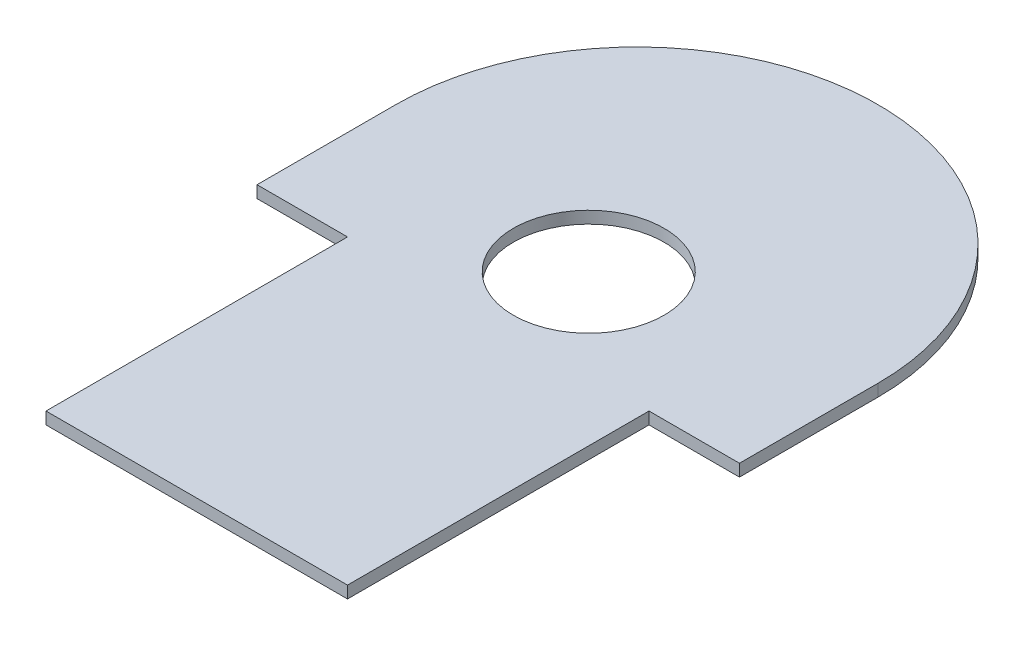
from build123d import *

# Parameters (mm, degrees)
BOSS_EXTRUDE1_DEPTH = 2
SKETCH2_R           = 12.5
SKETCH2_W           = 15
SKETCH2_H           = 50
CUT_EXTRUDE1_DEPTH  = 2


with BuildPart() as part:
    # Sketch1 → Boss-Extrude1 (new body)
    with BuildSketch(Plane(origin=(0, 0, 0), x_dir=(1, 0, 0), z_dir=(0, 1, 0))):
        with BuildLine():
            Line((-90.154867257, 35.610619469), (-90.154867257, -37.389380531))
            Line((-90.154867257, -37.389380531), (-10.154867257, -37.389380531))
            Line((-10.154867257, -37.389380531), (-10.154867257, 35.610619469))
            ThreePointArc((-10.154867257, 35.610619469), (-50.154867257, 75.610619469), (-90.154867257, 35.610619469))
        make_face()
    extrude(amount=BOSS_EXTRUDE1_DEPTH)

    # Sketch2 → Cut-Extrude1 (cut)
    with BuildSketch(Plane(origin=(0, 2, 0), x_dir=(1, 0, 0), z_dir=(0, 1, 0))):
        with Locations(Location((-50.154867257, 27.610619469, 0), (0, 0, 270))):
            Circle(SKETCH2_R)
        with Locations((-82.654867257, -12.389380531)):
            Rectangle(SKETCH2_W, SKETCH2_H)
        with Locations((-17.654867257, -12.389380531)):
            Rectangle(SKETCH2_W, SKETCH2_H)
    extrude(amount=-CUT_EXTRUDE1_DEPTH, mode=Mode.SUBTRACT)


solid = part.part
